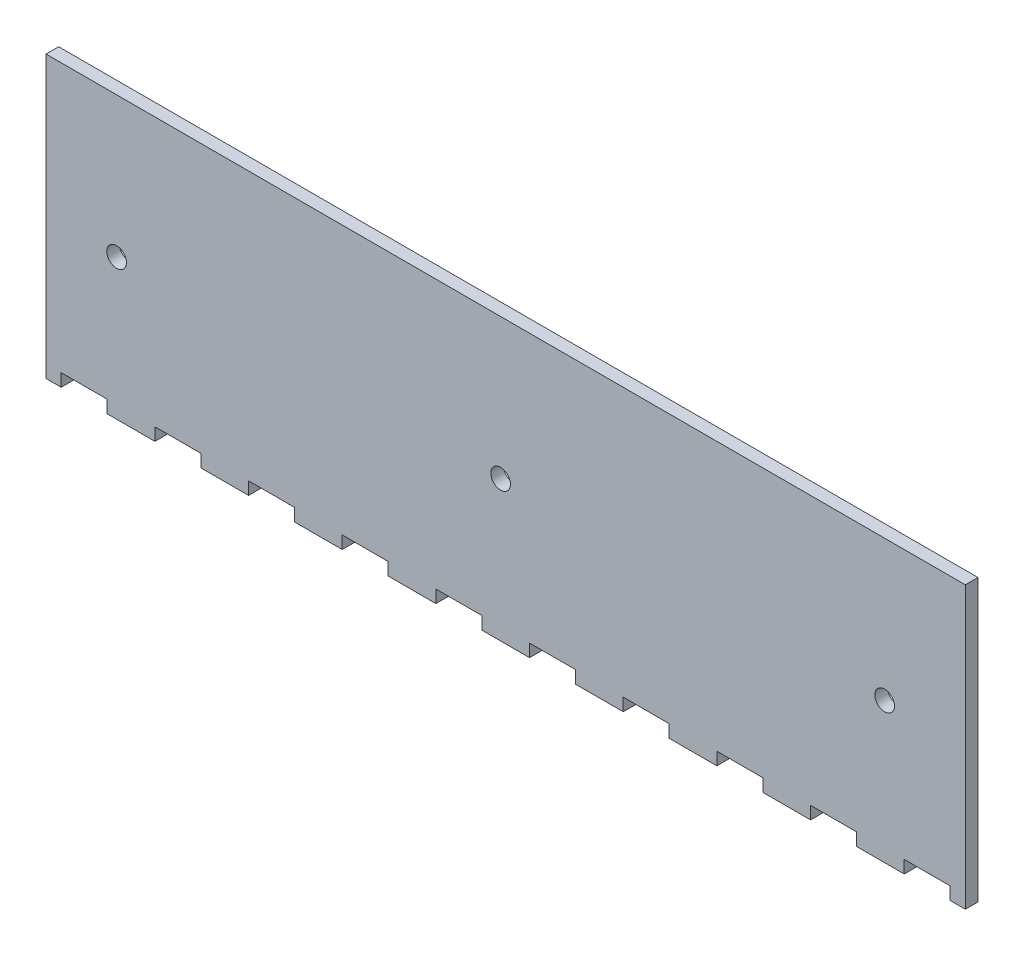
from build123d import *

# Parameters (mm, degrees)
ESQUISSE1_W                    = 196.3
ESQUISSE1_H                    = 60
BOSS_EXTRU_1_DEPTH             = 2.7
ESQUISSE3_W                    = 9.8
ESQUISSE3_H                    = 2.7
ENL_V_MAT_EXTRU_1_DEPTH        = 2.7
R_P_TITION_LIN_AIRE2_COUNT     = 5
R_P_TITION_LIN_AIRE2_PITCH     = 20
R_P_TITION_LIN_AIRE2_COL_COUNT = 6
R_P_TITION_LIN_AIRE2_COL_PITCH = 20
ESQUISSE5_R                    = 2.1
ENL_V_MAT_EXTRU_3_DEPTH        = 10


with BuildPart() as part:
    # Esquisse1 → Boss.-Extru.1 (new body)
    with BuildSketch(Plane.XY):
        with Locations((0, -30)):
            Rectangle(ESQUISSE1_W, ESQUISSE1_H)
    extrude(amount=BOSS_EXTRU_1_DEPTH)

    # Esquisse3 → Enlèv. mat.-Extru.1 (cut)
    with BuildSketch(Plane.XY):
        with Locations((10, -58.65)):
            Rectangle(ESQUISSE3_W, ESQUISSE3_H)
    enl_v_mat_extru_1 = extrude(amount=ENL_V_MAT_EXTRU_1_DEPTH, mode=Mode.SUBTRACT)

    # Répétition linéaire2: Enlèv. mat.-Extru.1 ×5
    with Locations(*[(i * R_P_TITION_LIN_AIRE2_PITCH, 0, 0) for i in range(1, R_P_TITION_LIN_AIRE2_COUNT)]):
        add(enl_v_mat_extru_1, mode=Mode.SUBTRACT)

    # Répétition linéaire2 col: Enlèv. mat.-Extru.1 ×6
    with Locations(*[(-i * R_P_TITION_LIN_AIRE2_COL_PITCH, 0, 0) for i in range(1, R_P_TITION_LIN_AIRE2_COL_COUNT)]):
        add(enl_v_mat_extru_1, mode=Mode.SUBTRACT)

    # Esquisse5 → Enlèv. mat.-Extru.3 (cut)
    with BuildSketch(Plane.XY):
        with Locations((-83.081, -30)):
            Circle(ESQUISSE5_R)
        with Locations((-1.081, -30)):
            Circle(ESQUISSE5_R)
        with Locations((80.919, -30)):
            Circle(ESQUISSE5_R)
    extrude(amount=ENL_V_MAT_EXTRU_3_DEPTH, mode=Mode.SUBTRACT)


solid = part.part
